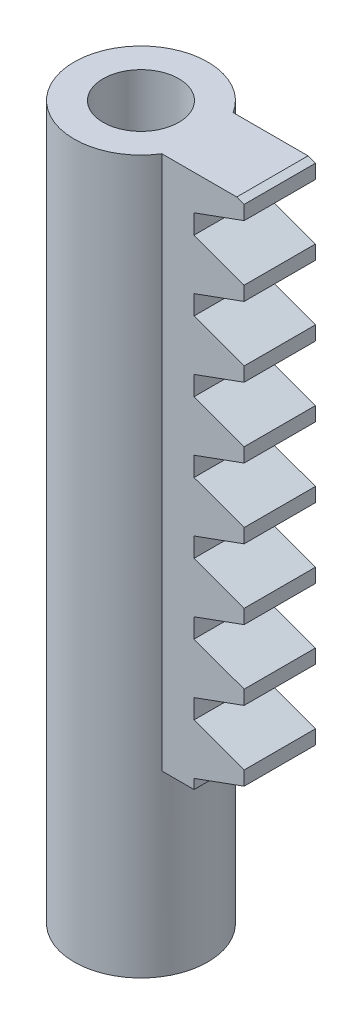
from build123d import *

# Parameters (mm, degrees)
SALIENTE_EXTRUIR1_DEPTH = 8
CROQUIS2_R              = 4.25
SALIENTE_EXTRUIR2_DEPTH = 80
CROQUIS4_R              = 1.5
CORTAR_EXTRUIR1_DEPTH   = 5
CROQUIS5_R              = 1.5
CORTAR_EXTRUIR2_DEPTH   = 7
SALIENTE_EXTRUIR3_START = -70
CROQUIS6_R              = 7.5
CROQUIS6_R_2            = 4.25
SALIENTE_EXTRUIR3_DEPTH = 70
CROQUIS7_R              = 1.5
CORTAR_EXTRUIR3_DEPTH   = 10
CROQUIS11_R             = 2.5
CORTAR_EXTRUIR4_DEPTH   = 1.8


with BuildPart() as part:
    # Croquis1 → Saliente-Extruir1 (new body)
    with BuildSketch(Plane(origin=(0, 0, 0), x_dir=(-1, 0, 0), z_dir=(0, 0, -1))):
        Polygon((-5.547383556, 27.615747118), (-5.547383556, 26.030607477), (0.077616444, 23.983274909), (0.077616444, 21.809098061), (-5.547383556, 19.761765493), (-5.547383556, 18.176625852), (0.077616444, 16.129293284), (0.077616444, 13.955116436), (-5.547383556, 11.907783868), (-5.547383556, 10.322644227), (0.077616444, 8.275311659), (0.077616444, 6.101134811), (-5.547383556, 4.053802243), (-5.547383556, 2.468662602), (0.077616444, 0.421330034), (0.077616444, -1.752846814), (-5.547383556, -3.800179382), (-5.547383556, -5.385319023), (0.077616444, -7.432651591), (0.077616444, -9.606828439), (-5.547383556, -11.654161007), (-5.547383556, -13.239300648), (0.077616444, -15.286633216), (0.077616444, -17.460810064), (-5.547383556, -19.508142632), (-5.547383556, -21.093282273), (0.077616444, -23.140614841), (0.077616444, -25.314791689), (-5.547383556, -27.362124257), (-5.547383556, -28.947263898), (0.077616444, -30.994596466), (0.077616444, -32.08168489), (4.952616444, -32.08168489), (4.952616444, 27.91831511), (-4.71608483, 27.91831511), align=None)
    extrude(amount=-SALIENTE_EXTRUIR1_DEPTH)

    # Croquis2 → Saliente-Extruir2 (add)
    with BuildSketch(Plane(origin=(0, 27.91831511, 0), x_dir=(1, 0, 0), z_dir=(0, 1, 0))):
        with BuildLine():
            Line((-4.952616444, -8), (-4.952616444, -4))
            Line((-4.952616444, -4), (-4.952616444, 0))
            Line((-4.952616444, 0), (-3.691152355, 0))
            ThreePointArc((-3.691152355, 0), (-17.535441126, -4), (-3.691152355, -8))
            Line((-3.691152355, -8), (-4.952616444, -8))
        make_face()
        with Locations(Location((-10.035441126, -4, 0), (0, 0, 270))):
            Circle(CROQUIS2_R, mode=Mode.SUBTRACT)
    extrude(amount=-SALIENTE_EXTRUIR2_DEPTH)

    # Croquis4 → Cortar-Extruir1 (cut)
    with BuildSketch(Plane.ZY.offset(17.535441126)):
        with Locations((4, 12.91831511)):
            Circle(CROQUIS4_R)
        with Locations((4, -37.08168489)):
            Circle(CROQUIS4_R)
    extrude(amount=-CORTAR_EXTRUIR1_DEPTH, mode=Mode.SUBTRACT)

    # Croquis5 → Cortar-Extruir2 (cut, symmetric)
    with BuildSketch(Plane.ZY.offset(17.535441126)):
        with Locations(Location((4, -12.08168489, 0), (0, 0, 180))):
            Circle(CROQUIS5_R)
    extrude(amount=CORTAR_EXTRUIR2_DEPTH, both=True, mode=Mode.SUBTRACT)

    # Croquis6 → Saliente-Extruir3 (add)
    with BuildSketch(Plane.XZ.offset(52.08168489).offset(SALIENTE_EXTRUIR3_START)):
        with Locations(Location((-10.035441126, 4, 0), (0, 0, 90))):
            Circle(CROQUIS6_R)
        with Locations(Location((-10.035441126, 4, 0), (0, 0, 90))):
            Circle(CROQUIS6_R_2, mode=Mode.SUBTRACT)
    extrude(amount=SALIENTE_EXTRUIR3_DEPTH)

    # Croquis7 → Cortar-Extruir3 (cut)
    with BuildSketch(Plane.ZY.offset(17.535441126)):
        with Locations((4, -12.08168489)):
            Circle(CROQUIS7_R)
        with Locations((4, -37.08168489)):
            Circle(CROQUIS7_R)
        with Locations((4, 12.91831511)):
            Circle(CROQUIS7_R)
    extrude(amount=-CORTAR_EXTRUIR3_DEPTH, mode=Mode.SUBTRACT)

    # Croquis11 → Cortar-Extruir4 (cut)
    with BuildSketch(Plane.ZY.offset(17.535441126)):
        with Locations((4, 12.91831511)):
            Circle(CROQUIS11_R)
        with Locations((4, -12.08168489)):
            Circle(CROQUIS11_R)
        with Locations((4, -37.08168489)):
            Circle(CROQUIS11_R)
    extrude(amount=-CORTAR_EXTRUIR4_DEPTH, mode=Mode.SUBTRACT)


solid = part.part
